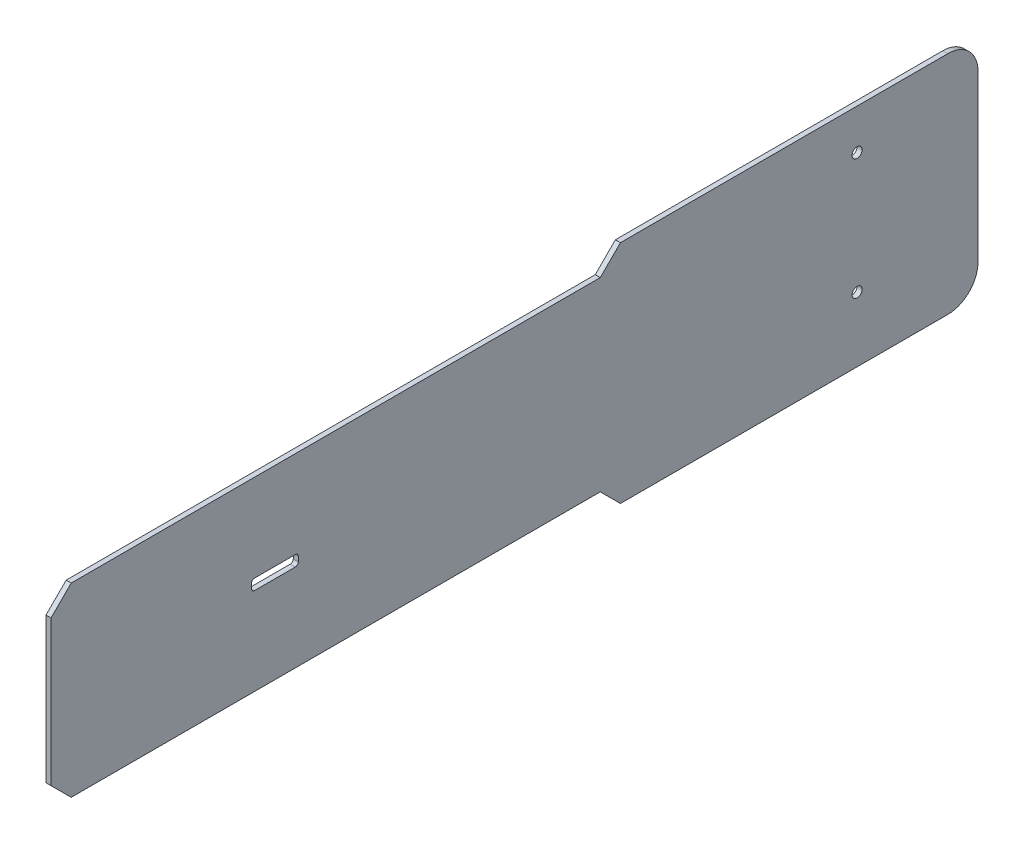
from build123d import *

# Parameters (mm, degrees)
SKETCH2_W           = 22.42
SKETCH2_H           = 92
BOSS_EXTRUDE2_DEPTH = 0.5
FILLET4_R           = 3
FILLET7_R           = 3
SKETCH4_W           = 2
SKETCH4_H           = 54.51
CUT_EXTRUDE1_DEPTH  = 0.5
SKETCH5_W           = 2
SKETCH5_H           = 54.51
CUT_EXTRUDE2_DEPTH  = 0.5
CUT_EXTRUDE3_DEPTH  = 0.5
CUT_EXTRUDE4_DEPTH  = 0.5
CUT_EXTRUDE7_DEPTH  = 0.5
CUT_EXTRUDE8_DEPTH  = 0.5
SKETCH11_W          = 1.07
SKETCH11_H          = 4.64
CUT_EXTRUDE9_DEPTH  = 0.5
FILLET8_R           = 0.3
FILLET9_R           = 0.3
FILLET10_R          = 0.3
FILLET11_R          = 0.3
SKETCH12_R          = 0.5
CUT_EXTRUDE11_DEPTH = 0.5
SKETCH13_R          = 0.5
CUT_EXTRUDE12_DEPTH = 5
CUT_EXTRUDE24_DEPTH = 0.07
CUT_EXTRUDE24_DRAFT = -44


with BuildPart() as part:
    # Sketch2 → Boss-Extrude2 (new body)
    with BuildSketch(Plane(origin=(0, 0, 0), x_dir=(0, 1, 0), z_dir=(-1, 0, 0))):
        with Locations((-43.813076923, -17.338461538)):
            Rectangle(SKETCH2_W, SKETCH2_H)
    extrude(amount=BOSS_EXTRUDE2_DEPTH)

    # Fillet4
    fillet4_edges = [part.edges().sort_by_distance(p)[0] for p in [
        (-0.25, -55.023076923, -28.661538462),
    ]]
    fillet(fillet4_edges, radius=FILLET4_R)

    # Fillet7
    fillet7_edges = [part.edges().sort_by_distance(p)[0] for p in [
        (-0.25, -32.603076923, -28.661538462),
    ]]
    fillet(fillet7_edges, radius=FILLET7_R)

    # Sketch4 → Cut-Extrude1 (cut)
    with BuildSketch(Plane(origin=(-0.5, 0, 0), x_dir=(0, 1, 0), z_dir=(-1, 0, 0))):
        with Locations((-54.023076923, -36.083461538)):
            Rectangle(SKETCH4_W, SKETCH4_H)
    extrude(amount=-CUT_EXTRUDE1_DEPTH, mode=Mode.SUBTRACT)

    # Sketch5 → Cut-Extrude2 (cut)
    with BuildSketch(Plane(origin=(-0.5, 0, 0), x_dir=(0, 1, 0), z_dir=(-1, 0, 0))):
        with Locations((-33.603076923, -36.083461538)):
            Rectangle(SKETCH5_W, SKETCH5_H)
    extrude(amount=-CUT_EXTRUDE2_DEPTH, mode=Mode.SUBTRACT)

    # Sketch6 → Cut-Extrude3 (cut)
    with BuildSketch(Plane(origin=(-0.5, 0, 0), x_dir=(0, 1, 0), z_dir=(-1, 0, 0))):
        Polygon((-53.023076923, -63.338461538), (-53.023076923, -61.338461538), (-51.023076923, -63.338461538), align=None)
    extrude(amount=-CUT_EXTRUDE3_DEPTH, mode=Mode.SUBTRACT)

    # Sketch7 → Cut-Extrude4 (cut)
    with BuildSketch(Plane(origin=(-0.5, 0, 0), x_dir=(0, 1, 0), z_dir=(-1, 0, 0))):
        Polygon((-34.603076923, -63.338461538), (-34.603076923, -61.338461538), (-36.603076923, -63.338461538), align=None)
    extrude(amount=-CUT_EXTRUDE4_DEPTH, mode=Mode.SUBTRACT)

    # Sketch8 → Cut-Extrude7 (cut)
    with BuildSketch(Plane(origin=(-0.5, 0, 0), x_dir=(0, 1, 0), z_dir=(-1, 0, 0))):
        Polygon((-53.023076923, -8.828461538), (-55.023076923, -8.828461538), (-55.023076923, -6.828461538), align=None)
    extrude(amount=-CUT_EXTRUDE7_DEPTH, mode=Mode.SUBTRACT)

    # Sketch9 → Cut-Extrude8 (cut)
    with BuildSketch(Plane(origin=(-0.5, 0, 0), x_dir=(0, 1, 0), z_dir=(-1, 0, 0))):
        Polygon((-34.603076923, -8.828461538), (-32.603076923, -8.828461538), (-32.603076923, -6.828461538), align=None)
    extrude(amount=-CUT_EXTRUDE8_DEPTH, mode=Mode.SUBTRACT)

    # Sketch11 → Cut-Extrude9 (cut)
    with BuildSketch(Plane(origin=(-0.5, 0, 0), x_dir=(0, 1, 0), z_dir=(-1, 0, 0))):
        with Locations((-43.813076923, -41.118461538)):
            Rectangle(SKETCH11_W, SKETCH11_H)
    extrude(amount=-CUT_EXTRUDE9_DEPTH, mode=Mode.SUBTRACT)

    # Fillet8
    fillet8_edges = [part.edges().sort_by_distance(p)[0] for p in [
        (-0.25, -44.348076923, 38.798461538),
    ]]
    fillet(fillet8_edges, radius=FILLET8_R)

    # Fillet9
    fillet9_edges = [part.edges().sort_by_distance(p)[0] for p in [
        (-0.25, -43.278076923, 38.798461538),
    ]]
    fillet(fillet9_edges, radius=FILLET9_R)

    # Fillet10
    fillet10_edges = [part.edges().sort_by_distance(p)[0] for p in [
        (-0.25, -43.278076923, 43.438461538),
    ]]
    fillet(fillet10_edges, radius=FILLET10_R)

    # Fillet11
    fillet11_edges = [part.edges().sort_by_distance(p)[0] for p in [
        (-0.25, -44.348076923, 43.438461538),
    ]]
    fillet(fillet11_edges, radius=FILLET11_R)

    # Sketch12 → Cut-Extrude11 (cut)
    with BuildSketch(Plane(origin=(-0.5, 0, 0), x_dir=(0, 1, 0), z_dir=(-1, 0, 0))):
        with Locations(Location((-36.603076923, 16.661538462, 0), (0, 0, 180))):
            Circle(SKETCH12_R)
    extrude(amount=-CUT_EXTRUDE11_DEPTH, mode=Mode.SUBTRACT)

    # Sketch13 → Cut-Extrude12 (cut)
    with BuildSketch(Plane(origin=(-0.5, 0, 0), x_dir=(0, 1, 0), z_dir=(-1, 0, 0))):
        with Locations(Location((-48.603076923, 16.661538462, 0), (0, 0, 180))):
            Circle(SKETCH13_R)
    extrude(amount=-CUT_EXTRUDE12_DEPTH, mode=Mode.SUBTRACT)


with BuildPart() as cut_extrude24_tool:
    # Sketch25 → Cut-Extrude24 (with draft: the straight prism first)
    with BuildSketch(Plane(origin=(-0.5, 0, 0), x_dir=(0, 1, 0), z_dir=(-1, 0, 0))):
        with BuildLine():
            ThreePointArc((-36.592742355, 3.286363935), (-36.557004391, 3.334036273), (-36.544326341, 3.39225243))
            Line((-36.544326341, 3.39225243), (-36.544326341, 16.851858083))
            Line((-36.544326341, 16.851858083), (-36.684326341, 16.851858083))
            Line((-36.684326341, 16.851858083), (-36.684326341, 3.456265446))
            ThreePointArc((-36.684326341, 3.456265446), (-36.697004391, 3.398049289), (-36.732742355, 3.350376951))
            Line((-36.732742355, 3.350376951), (-43.834660909, -2.792141227))
            ThreePointArc((-43.834660909, -2.792141227), (-43.870398873, -2.839813565), (-43.883076923, -2.898029723))
            Line((-43.883076923, -2.898029723), (-43.883076923, -52.213504668))
            ThreePointArc((-43.883076923, -52.213504668), (-46.208076923, -54.538504668), (-48.533076923, -52.213504668))
            Line((-48.533076923, -52.213504668), (-48.533076923, 16.646534236))
            Line((-48.533076923, 16.646534236), (-48.673076923, 16.646534236))
            Line((-48.673076923, 16.646534236), (-48.673076923, -52.213504668))
            ThreePointArc((-48.673076923, -52.213504668), (-46.208076923, -54.678504668), (-43.743076923, -52.213504668))
            Line((-43.743076923, -52.213504668), (-43.743076923, -2.962042739))
            ThreePointArc((-43.743076923, -2.962042739), (-43.730398873, -2.903826581), (-43.694660909, -2.856154243))
            Line((-43.694660909, -2.856154243), (-36.592742355, 3.286363935))
        make_face()
    extrude(amount=-CUT_EXTRUDE24_DEPTH)
    # Cut-Extrude24: the draft: its side faces are tilted about the plane it starts from
    cut_extrude24_sides = [cut_extrude24_tool.faces().sort_by_distance(p)[0] for p in [
        (-0.465, -40.143701632, -0.215104846),
        (-0.465, -36.557004391, -3.334036273),
        (-0.465, -36.544326341, -10.122055257),
        (-0.465, -36.614326341, -16.851858083),
        (-0.465, -36.684326341, -10.154061765),
        (-0.465, -36.697004391, -3.398049289),
        (-0.465, -40.283701632, -0.279117862),
        (-0.465, -43.870398873, 2.839813565),
        (-0.465, -43.883076923, 27.555767195),
        (-0.465, -46.208076923, 54.538504668),
        (-0.465, -48.533076923, 17.783485216),
        (-0.465, -48.603076923, -16.646534236),
        (-0.465, -48.673076923, 17.783485216),
        (-0.465, -46.208076923, 54.678504668),
        (-0.465, -43.743076923, 27.587773703),
        (-0.465, -43.730398873, 2.903826581),
    ]]
    draft(cut_extrude24_sides, Plane(origin=(-0.5, 0, 0), x_dir=(0, 1, 0), z_dir=(-1, 0, 0)), CUT_EXTRUDE24_DRAFT)


with BuildPart() as part_1:
    add(part.part)

    # Cut-Extrude24: cut by cut_extrude24_tool
    add(cut_extrude24_tool.part, mode=Mode.SUBTRACT)


solid = part_1.part
